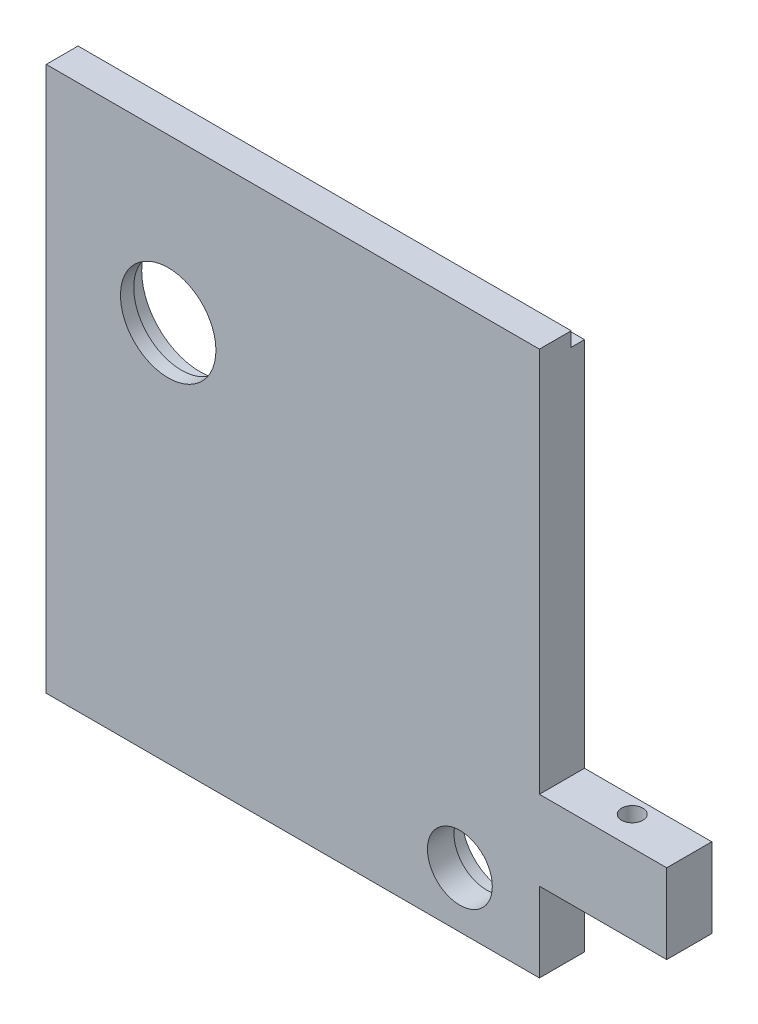
from build123d import *

# Parameters (mm, degrees)
SKETCH1_W           = 93
SKETCH1_H           = 102.7
BOSS_EXTRUDE2_DEPTH = 6
SKETCH3_W           = 35
SKETCH3_H           = 100
BOSS_EXTRUDE3_DEPTH = 2.5
SKETCH4_W           = 8.5
SKETCH4_H           = 15
BOSS_EXTRUDE4_DEPTH = 24
SKETCH5_R           = 2
CUT_EXTRUDE1_DEPTH  = 50
SKETCH6_R           = 8.115
CUT_EXTRUDE2_DEPTH  = 50
SKETCH7_R           = 11
CUT_EXTRUDE3_DEPTH  = 50
EXTRUDE_THIN1_START = -3.5
SKETCH7_AGAIN_R     = 11
SKETCH7_AGAIN_R_2   = 9
EXTRUDE_THIN1_DEPTH = 2.5
EXTRUDE_THIN2_START = -3.5
SKETCH6_2_R         = 8.115
SKETCH6_2_R_2       = 6.115
EXTRUDE_THIN2_DEPTH = 5


with BuildPart() as part:
    # Sketch1 → Boss-Extrude2 (new body)
    with BuildSketch(Plane.XY):
        with Locations((-29.68705036, 16.278057554)):
            Rectangle(SKETCH1_W, SKETCH1_H)
    extrude(amount=BOSS_EXTRUDE2_DEPTH)

    # Sketch3 → Boss-Extrude3 (add)
    with BuildSketch(Plane(origin=(0, 0, 0), x_dir=(-1, 0, 0), z_dir=(0, 0, -1))):
        with Locations((0.68705036, 14.928057554)):
            Rectangle(SKETCH3_W, SKETCH3_H)
    extrude(amount=BOSS_EXTRUDE3_DEPTH)

    # Sketch4 → Boss-Extrude4 (add)
    with BuildSketch(Plane(origin=(16.81294964, 0, 0), x_dir=(0, 0, -1), z_dir=(1, 0, 0))):
        with Locations((-1.75, -12.571942446)):
            Rectangle(SKETCH4_W, SKETCH4_H)
    extrude(amount=BOSS_EXTRUDE4_DEPTH)

    # Sketch5 → Cut-Extrude1 (cut)
    with BuildSketch(Plane(origin=(0, -5.071942446, 0), x_dir=(1, 0, 0), z_dir=(0, 1, 0))):
        with Locations(Location((28.81294964, -0.5, 0), (0, 0, 180))):
            Circle(SKETCH5_R)
    extrude(amount=-CUT_EXTRUDE1_DEPTH, mode=Mode.SUBTRACT)

    # Sketch6 → Cut-Extrude2 (cut)
    with BuildSketch(Plane(origin=(0, 0, -2.5), x_dir=(-1, 0, 0), z_dir=(0, 0, -1))):
        with Locations((-1.81294964, -24.571942446)):
            Circle(SKETCH6_R)
    extrude(amount=-CUT_EXTRUDE2_DEPTH, mode=Mode.SUBTRACT)

    # Sketch7 → Cut-Extrude3 (cut)
    with BuildSketch(Plane(origin=(0, 0, 0), x_dir=(-1, 0, 0), z_dir=(0, 0, -1))):
        with Locations((53.18705036, 36.928057554)):
            Circle(SKETCH7_R)
    extrude(amount=-CUT_EXTRUDE3_DEPTH, mode=Mode.SUBTRACT)

    # Sketch7 again → Extrude-Thin1 (add)
    with BuildSketch(Plane(origin=(0, 0, 0), x_dir=(-1, 0, 0), z_dir=(0, 0, -1)).offset(EXTRUDE_THIN1_START)):
        with Locations((53.18705036, 36.928057554)):
            Circle(SKETCH7_AGAIN_R)
        with Locations((53.18705036, 36.928057554)):
            Circle(SKETCH7_AGAIN_R_2, mode=Mode.SUBTRACT)
    extrude(amount=-EXTRUDE_THIN1_DEPTH)

    # Sketch6<2> → Extrude-Thin2 (add)
    with BuildSketch(Plane(origin=(0, 0, -2.5), x_dir=(-1, 0, 0), z_dir=(0, 0, -1)).offset(EXTRUDE_THIN2_START)):
        with Locations((-1.81294964, -24.571942446)):
            Circle(SKETCH6_2_R)
        with Locations((-1.81294964, -24.571942446)):
            Circle(SKETCH6_2_R_2, mode=Mode.SUBTRACT)
    extrude(amount=-EXTRUDE_THIN2_DEPTH)


solid = part.part
